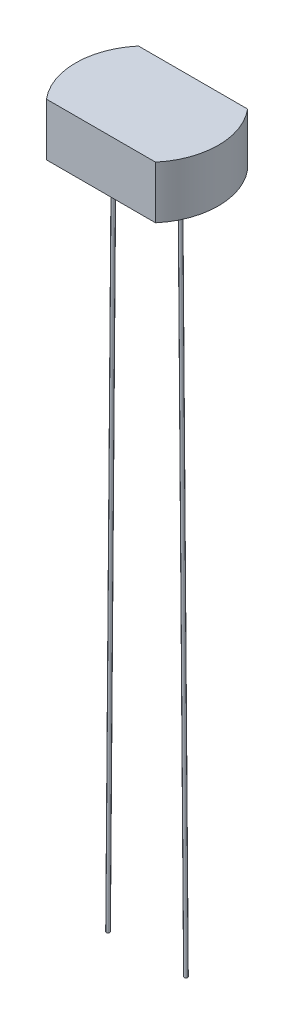
from build123d import *

# Parameters (mm, degrees)
BOSS_EXTRUDE1_DEPTH = 2
SKETCH3_R           = 0.0635


with BuildPart() as part:
    # Sketch1 → Boss-Extrude1 (new body)
    with BuildSketch(Plane(origin=(0, 0, 0), x_dir=(1, 0, 0), z_dir=(0, 1, 0))):
        with BuildLine():
            Line((-2.075, 1.75), (2.075, 1.75))
            ThreePointArc((2.075, 1.75), (2.714429038, 0), (2.075, -1.75))
            Line((2.075, -1.75), (-2.075, -1.75))
            ThreePointArc((-2.075, -1.75), (-2.714429038, 0), (-2.075, 1.75))
        make_face()
    extrude(amount=BOSS_EXTRUDE1_DEPTH)

    # Sweep1: sweep along a path in Sketch2
    with BuildLine(Plane.XY) as sweep1_path:
        Line((-2.075, 0), (-2.286, -26))
    # Sketch3 → Sweep1 (sweep)
    with BuildSketch(Plane.XZ):
        with Locations((-1.27, 0)):
            Circle(SKETCH3_R)
    sweep1 = sweep(path=sweep1_path.line)

    # Mirror1: Sweep1 across plane
    add(sweep1.mirror(Plane(origin=(0, 0, 0), x_dir=(0, 0, 1), z_dir=(1, 0, 0))))


solid = part.part
